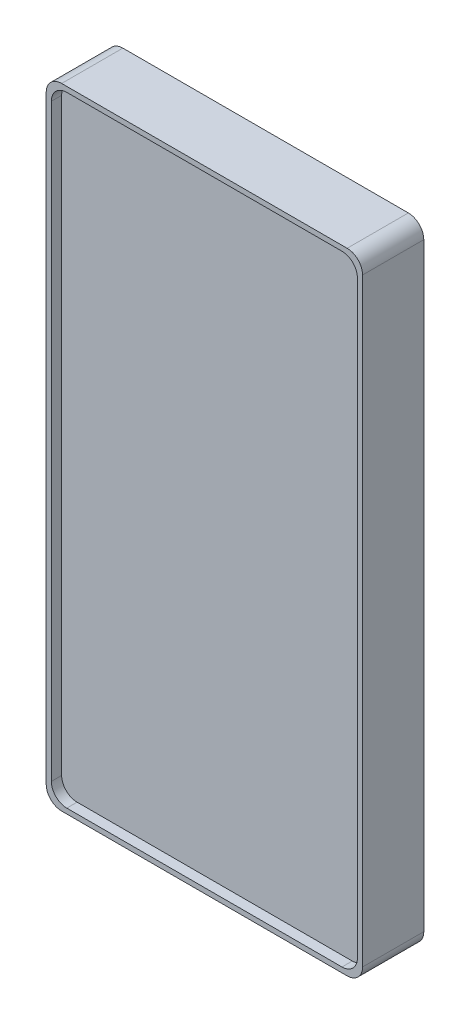
from build123d import *

# Parameters (mm, degrees)
SKETCH_1_W          = 615
SKETCH_1_H          = 1225
EXTRUDE_1_DEPTH     = 119
SKETCH_3_W          = 595
SKETCH_3_H          = 1205
CUT_EXTRUDE_1_DEPTH = 20
FILLET_3_R          = 30


with BuildPart() as part:
    # 스케치1 → 보스-돌출1 (new body)
    with BuildSketch(Plane.XY):
        with Locations((-307.5, 612.5)):
            Rectangle(SKETCH_1_W, SKETCH_1_H)
    extrude(amount=EXTRUDE_1_DEPTH)

    # 스케치3 → 컷-돌출1 (cut)
    with BuildSketch(Plane.XY.offset(119)):
        with Locations((-307.5, 612.5)):
            Rectangle(SKETCH_3_W, SKETCH_3_H)
    extrude(amount=-CUT_EXTRUDE_1_DEPTH, mode=Mode.SUBTRACT)

    # 필렛3
    fillet_3_edges = [part.edges().sort_by_distance(p)[0] for p in [
        (-10, 1215, 109),
        (-10, 10, 109),
        (-605, 10, 109),
        (-605, 1215, 109),
        (0, 0, 59.5),
        (-615, 0, 59.5),
        (-615, 1225, 59.5),
        (0, 1225, 59.5),
    ]]
    fillet(fillet_3_edges, radius=FILLET_3_R)


solid = part.part
